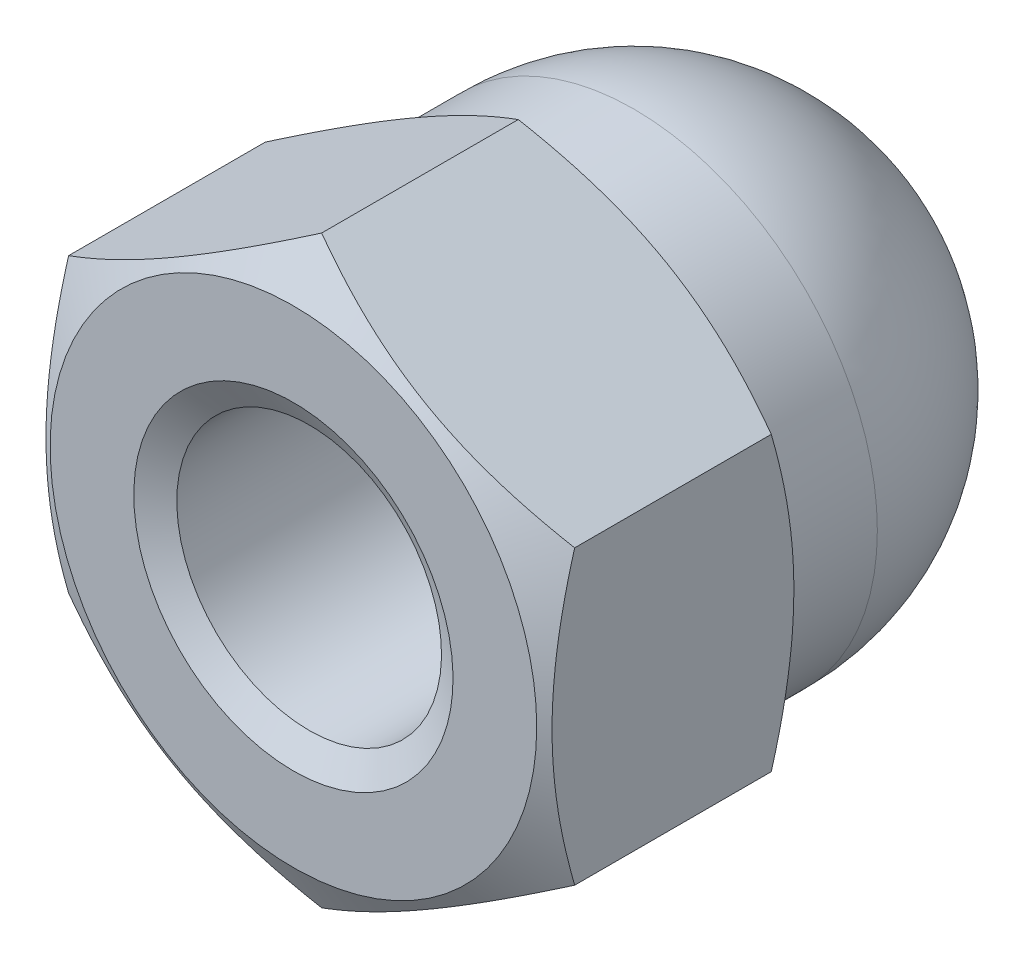
from build123d import *

# Parameters (mm, degrees)
BOSS_EXTRUDE1_DEPTH = 15


with BuildPart() as part:
    # Sketch1 → Boss-Extrude1 (new body)
    with BuildSketch(Plane.XY):
        Polygon((0, 7.505553499), (-6.5, 3.75277675), (-6.5, -3.75277675), (0, -7.505553499), (6.5, -3.75277675), (6.5, 3.75277675), align=None)
    extrude(amount=-BOSS_EXTRUDE1_DEPTH)

    # Sketch2 → Cut-Revolve7 (revolve, cut)
    with BuildSketch(Plane(origin=(0, 0, 0), x_dir=(0, 0, -1), z_dir=(1, 0, 0))):
        with BuildLine():
            Line((16, 0), (15, 0))
            ThreePointArc((15, 0), (13.169417382, 4.419417382), (8.75, 6.25))
            Line((8.75, 6.25), (6.5, 6.25))
            Line((6.5, 6.25), (6.5, 30.553605498))
            Line((6.5, 30.553605498), (16, 30.553605498))
            Line((16, 30.553605498), (16, 0))
        make_face()
    revolve(axis=Axis((0, 0, 0), (0, 0, -1)), mode=Mode.SUBTRACT)

    # Sketch3 → Cut-Revolve8 (revolve, cut)
    with BuildSketch(Plane(origin=(0, 0, 0), x_dir=(0, 0, -1), z_dir=(1, 0, 0)), mode=Mode.PRIVATE) as cut_revolve8_sk:
        Polygon((5.775105849, 7.505553499), (6.5, 7.505553499), (6.5, 6.25), align=None)
        Polygon((0, 6.25), (0, 7.505553499), (0.724894151, 7.505553499), align=None)
    revolve(cut_revolve8_sk.sketch.rotate(Axis((0, 0, 0), (0, 0, -1)), 90), axis=Axis((0, 0, 0), (0, 0, -1)), mode=Mode.SUBTRACT)

    # Sketch4 → Cut-Revolve9 (revolve, cut)
    with BuildSketch(Plane(origin=(0, 0, 0), x_dir=(0, 0, -1), z_dir=(1, 0, 0)), mode=Mode.PRIVATE) as cut_revolve9_sk:
        Polygon((0, 4.1), (0.404145188, 3.4), (10.65, 3.4), (13, 0), (0, 0), align=None)
    revolve(cut_revolve9_sk.sketch.rotate(Axis((0, 0, 0), (0, 0, -1)), 180), axis=Axis((0, 0, 0), (0, 0, -1)), mode=Mode.SUBTRACT)


solid = part.part
